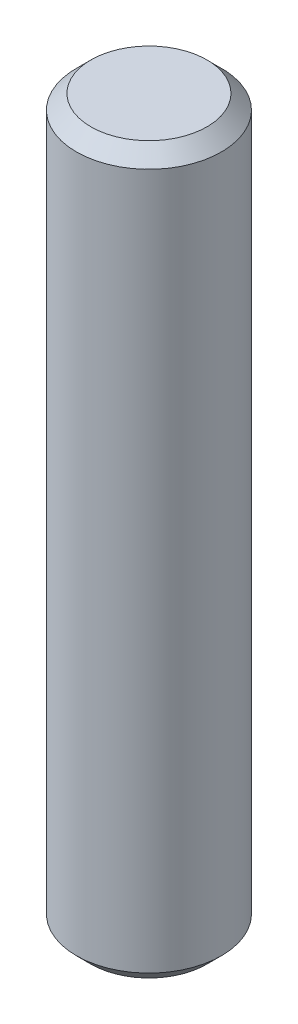
from build123d import *

# Parameters (mm, degrees)
SKETCH1_R         = 5
CORPO_DEPTH       = 50
CHANFRO_1_45_SIZE = 1


with BuildPart() as part:
    # Sketch1 → Corpo (new body)
    with BuildSketch(Plane(origin=(0, 0, 0), x_dir=(1, 0, 0), z_dir=(0, 1, 0))):
        with Locations(Location((0, 0, 0), (0, 0, 270))):
            Circle(SKETCH1_R)
    extrude(amount=CORPO_DEPTH)

    # Chanfro 1×45°
    chanfro_1_45_edges = [part.edges().sort_by_distance(p)[0] for p in [
        (0, 0, -5),
        (0, 50, -5),
    ]]
    chamfer(chanfro_1_45_edges, length=CHANFRO_1_45_SIZE)


solid = part.part
